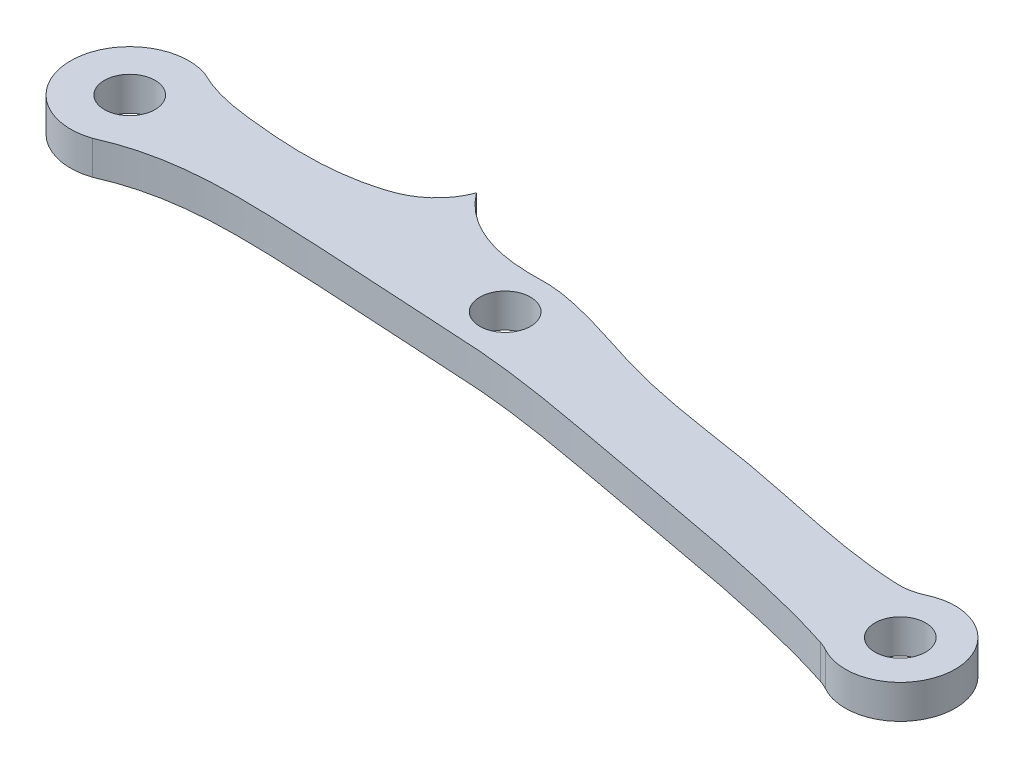
from build123d import *

# Parameters (mm, degrees)
SKETCH1_R           = 15
BOSS_EXTRUDE1_DEPTH = 20


with BuildPart() as part:
    # Sketch1 → Boss-Extrude1 (new body)
    with BuildSketch(Plane(origin=(0, 0, 0), x_dir=(1, 0, 0), z_dir=(0, 1, 0))):
        with BuildLine():
            ThreePointArc((11.227844922, 33.150196054), (-35, 0), (11.227844922, -33.150196054))
            add(Edge.make_bspline(
                [(11.227844922, -33.150196054), (41.416756554, -19.545808717), (109.617018015, -19.594351387), (185.823720385, -25.106561365), (260.889286261, -28.726337393), (314.998938133, -40.103473751), (397.029783508, -54.530146852), (449.771483959, -64.724410895), (484.590684969, -76.125683189)],
                knots=[0, 0, 0, 0, 0.199281033, 0.408196703, 0.458288105, 0.673316503, 0.728275548, 0.981000001, 0.981000001, 0.981000001, 0.981000001], degree=3))
            ThreePointArc((484.590684969, -76.125683189), (487.266305561, -77.14558579), (489.832502579, -78.415932093))
            ThreePointArc((489.832502579, -78.415932093), (538.108178019, -51.044742092), (491.671127053, -20.658508715))
            ThreePointArc((491.671127053, -20.658508715), (484.736802135, -22.969082695), (477.449535042, -23.534195515))
            add(Edge.make_bspline(
                [(152.56997847, 52.446429488), (169.216290541, 30.251346727), (199.499803962, 25.985470169), (229.531039993, 27.599739832), (258.115601287, 19.371257227), (295.67818393, 6.785427982), (325.978973641, 0.976639679), (396.041080311, -9.067135125), (440.0323422, -21.859432111), (477.449535042, -23.534195515)],
                knots=[0, 0, 0, 0, 0.156649967, 0.187428866, 0.294415647, 0.335473832, 0.556952529, 0.622371723, 0.961980935, 0.961980935, 0.961980935, 0.961980935], degree=3))
            add(Edge.make_bspline(
                [(11.227844922, 33.150196054), (24.935887318, 26.125648633), (59.92557902, 21.305654623), (100.800901739, 19.39116832), (138.449474199, 31.26413754), (149.180734347, 42.659021766), (152.56997847, 52.446429488)],
                knots=[0, 0, 0, 0, 0.279361214, 0.721038744, 0.798623592, 1, 1, 1, 1], degree=3))
        make_face()
        with Locations(Location((0, 0, 0), (0, 0, 270))):
            Circle(SKETCH1_R, mode=Mode.SUBTRACT)
        with Locations(Location((222, 0, 0), (0, 0, 270))):
            Circle(SKETCH1_R, mode=Mode.SUBTRACT)
        with Locations(Location((505.624632868, -50.010675168, 0), (0, 0, 270))):
            Circle(SKETCH1_R, mode=Mode.SUBTRACT)
    extrude(amount=BOSS_EXTRUDE1_DEPTH)


solid = part.part
